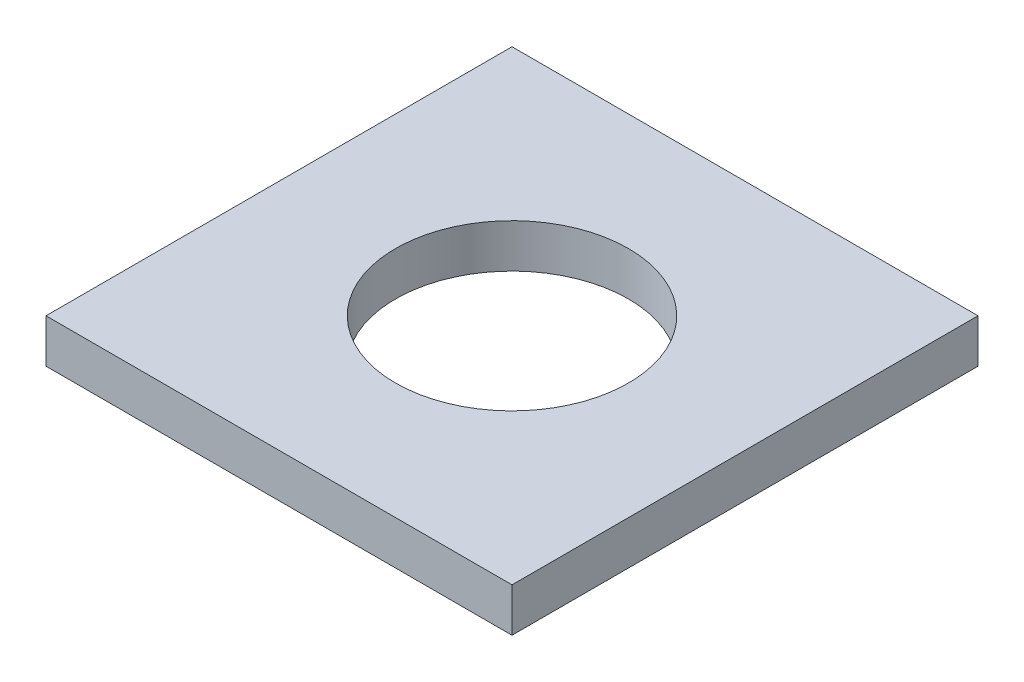
from build123d import *

# Parameters (mm, degrees)
SKETCH1_W           = 50.8
SKETCH1_H           = 50.8
BOSS_EXTRUDE1_DEPTH = 4.7625
CUT_EXTRUDE1_REACH  = 38.235
SKETCH2_R           = 12.7


with BuildPart() as part:
    # Sketch1 → Boss-Extrude1 (new body)
    with BuildSketch(Plane(origin=(0, 0, 0), x_dir=(1, 0, 0), z_dir=(0, 1, 0))):
        Rectangle(SKETCH1_W, SKETCH1_H)
    extrude(amount=BOSS_EXTRUDE1_DEPTH)

    # Sketch2 → Cut-Extrude1 (cut, up to next)
    with BuildSketch(Plane(origin=(0, 4.7625, 0), x_dir=(1, 0, 0), z_dir=(0, 1, 0)), mode=Mode.PRIVATE) as cut_extrude1_sk1:
        with Locations(Location((0, 0, 0), (0, 0, 270))):
            Circle(SKETCH2_R)
    cut_extrude1_tool1 = extrude(cut_extrude1_sk1.sketch, amount=-CUT_EXTRUDE1_REACH, mode=Mode.PRIVATE) & part.part
    add(cut_extrude1_tool1.solids().sort_by_distance((0, 4.7625, 0))[0], mode=Mode.SUBTRACT)


solid = part.part
